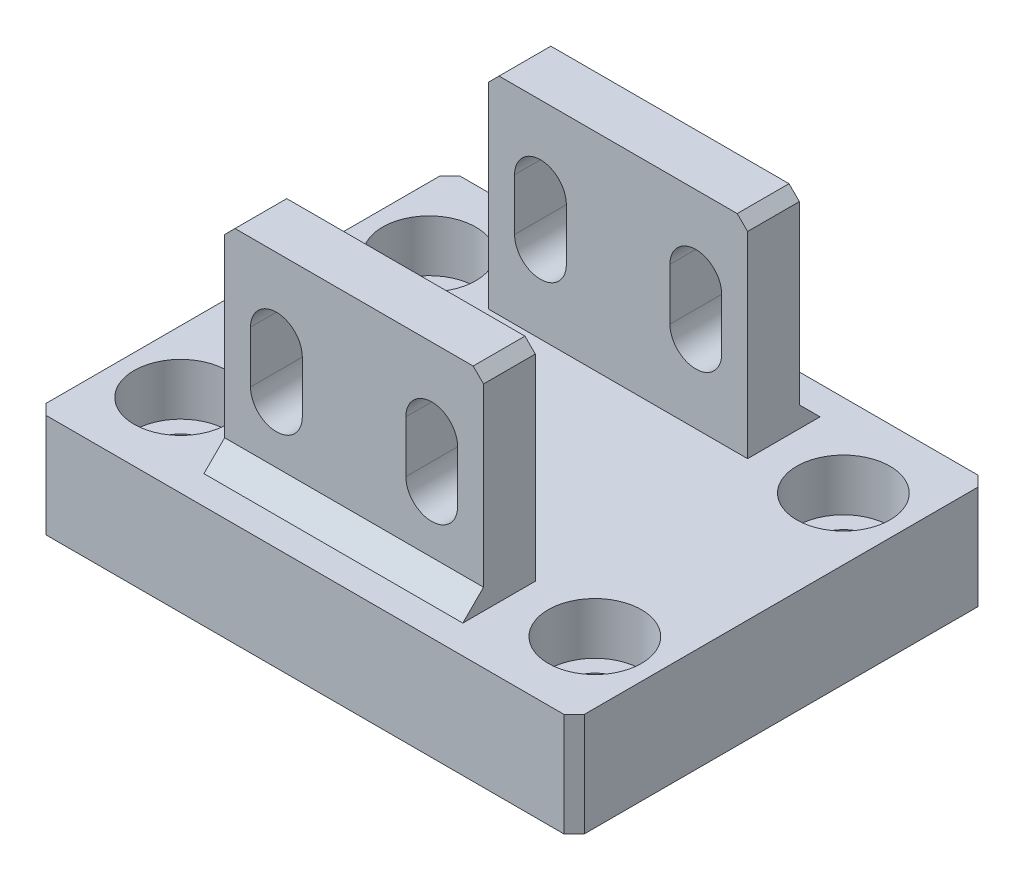
from build123d import *

# Parameters (mm, degrees)
SKETCH1_W           = 52
SKETCH1_H           = 40
SKETCH1_R           = 2.75
BOSS_EXTRUDE1_DEPTH = 10
SKETCH4_R           = 4.5
CUT_EXTRUDE2_DEPTH  = 5
BOSS_EXTRUDE2_START = -13.5
SKETCH2_W           = 5
SKETCH2_H           = 20
BOSS_EXTRUDE2_DEPTH = 25
CUT_EXTRUDE1_REACH  = 55.09
CHAMFER1_SIZE       = 2
CHAMFER2_SIZE       = 1


with BuildPart() as part:
    # Sketch1 → Boss-Extrude1 (new body)
    with BuildSketch(Plane(origin=(0, 0, 0), x_dir=(1, 0, 0), z_dir=(0, 1, 0))):
        Rectangle(SKETCH1_W, SKETCH1_H)
        with Locations(Location((-20, 12, 0), (0, 0, 270))):
            Circle(SKETCH1_R, mode=Mode.SUBTRACT)
        with Locations(Location((20, 12, 0), (0, 0, 270))):
            Circle(SKETCH1_R, mode=Mode.SUBTRACT)
        with Locations(Location((20, -12, 0), (0, 0, 270))):
            Circle(SKETCH1_R, mode=Mode.SUBTRACT)
        with Locations(Location((-20, -12, 0), (0, 0, 270))):
            Circle(SKETCH1_R, mode=Mode.SUBTRACT)
    extrude(amount=BOSS_EXTRUDE1_DEPTH)

    # Sketch4 → Cut-Extrude2 (cut)
    with BuildSketch(Plane(origin=(0, 10, 0), x_dir=(1, 0, 0), z_dir=(0, 1, 0))):
        with Locations(Location((-20, 12, 0), (0, 0, 270))):
            Circle(SKETCH4_R)
        with Locations(Location((20, 12, 0), (0, 0, 270))):
            Circle(SKETCH4_R)
        with Locations(Location((20, -12, 0), (0, 0, 270))):
            Circle(SKETCH4_R)
        with Locations(Location((-20, -12, 0), (0, 0, 270))):
            Circle(SKETCH4_R)
    extrude(amount=-CUT_EXTRUDE2_DEPTH, mode=Mode.SUBTRACT)

    # Sketch2 → Boss-Extrude2 (add)
    with BuildSketch(Plane(origin=(26, 0, 0), x_dir=(0, 0, -1), z_dir=(1, 0, 0)).offset(BOSS_EXTRUDE2_START)):
        with Locations((-12.75, 20)):
            Rectangle(SKETCH2_W, SKETCH2_H)
        with Locations((12.75, 20)):
            Rectangle(SKETCH2_W, SKETCH2_H)
    extrude(amount=-BOSS_EXTRUDE2_DEPTH)

    # Cut-Extrude1: up to this face of the body (flat: up to its plane)
    cut_extrude1_end = Plane(part.part.faces().sort_by_distance((0, 20, -15.25))[0])
    # Sketch3 → Cut-Extrude1 (cut, up to the picked face)
    with BuildSketch(Plane.XY.offset(15.25), mode=Mode.PRIVATE) as cut_extrude1_sk1:
        with BuildLine():
            Line((-5, 22.5), (-5, 17.5))
            ThreePointArc((-5, 17.5), (-7.5, 15), (-10, 17.5))
            Line((-10, 17.5), (-10, 22.5))
            ThreePointArc((-10, 22.5), (-7.5, 25), (-5, 22.5))
        make_face()
    cut_extrude1_tool1 = split(extrude(cut_extrude1_sk1.sketch, amount=-CUT_EXTRUDE1_REACH, mode=Mode.PRIVATE), bisect_by=cut_extrude1_end, keep=Keep.BOTH, mode=Mode.PRIVATE)
    # Sketch3 → Cut-Extrude1 (cut, up to the picked face)
    with BuildSketch(Plane.XY.offset(15.25), mode=Mode.PRIVATE) as cut_extrude1_sk2:
        with BuildLine():
            Line((10, 22.5), (10, 17.5))
            ThreePointArc((10, 17.5), (7.5, 15), (5, 17.5))
            Line((5, 17.5), (5, 22.5))
            ThreePointArc((5, 22.5), (7.5, 25), (10, 22.5))
        make_face()
    cut_extrude1_tool2 = split(extrude(cut_extrude1_sk2.sketch, amount=-CUT_EXTRUDE1_REACH, mode=Mode.PRIVATE), bisect_by=cut_extrude1_end, keep=Keep.BOTH, mode=Mode.PRIVATE)
    add(cut_extrude1_tool1.solids().sort_by(Axis((-7.5, 20, 15.25), (0, 0, -1)))[0], mode=Mode.SUBTRACT)
    add(cut_extrude1_tool2.solids().sort_by(Axis((7.5, 20, 15.25), (0, 0, -1)))[0], mode=Mode.SUBTRACT)

    # Chamfer1
    chamfer1_edges = [part.edges().sort_by_distance(p)[0] for p in [
        (0, 10, 15.25),
        (0, 10, -15.25),
    ]]
    chamfer(chamfer1_edges, length=CHAMFER1_SIZE)

    # Chamfer2
    chamfer2_edges = [part.edges().sort_by_distance(p)[0] for p in [
        (-12.5, 30, 12.75),
        (12.5, 30, 12.75),
        (-12.5, 30, -12.75),
        (12.5, 30, -12.75),
        (26, 5, 20),
        (-26, 5, 20),
        (-26, 5, -20),
        (26, 5, -20),
    ]]
    chamfer(chamfer2_edges, length=CHAMFER2_SIZE)


solid = part.part
